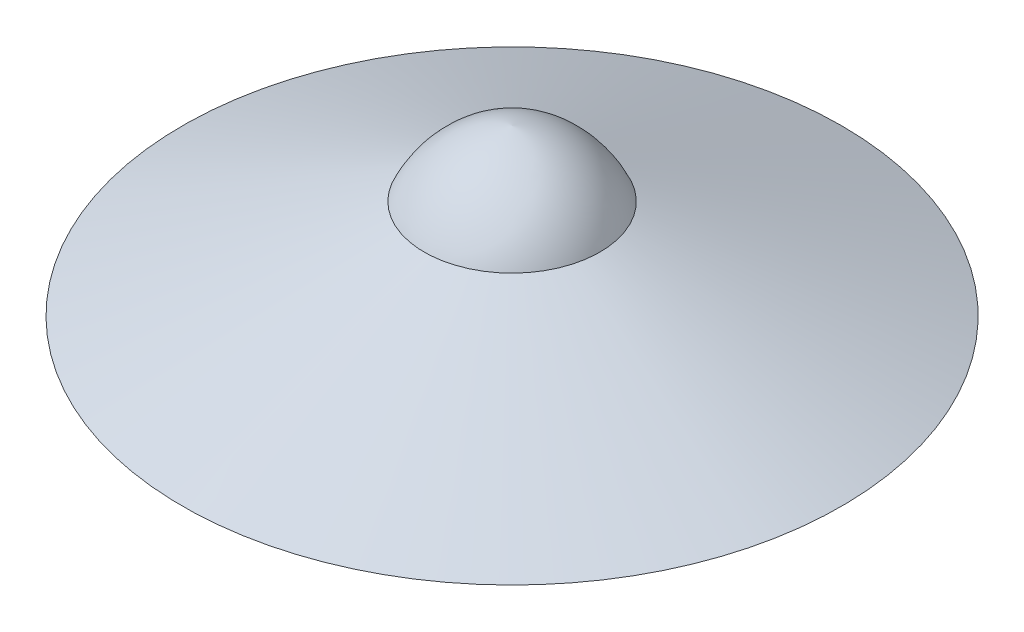
from build123d import *


with BuildPart() as part:
    # Эскиз1 → Повернуть1 (revolve)
    with BuildSketch(Plane(origin=(0, 0, 0), x_dir=(0, 0, -1), z_dir=(1, 0, 0))):
        with BuildLine():
            Line((0, 0), (6, 0))
            Line((6, 0), (1.599558116, 1.80595603))
            ThreePointArc((1.599558116, 1.80595603), (0.95267314, 2.60779708), (0, 3))
            Line((0, 3), (0, 0))
        make_face()
    revolve(axis=Axis((0, 0, 0), (0, 1, 0)))


solid = part.part
